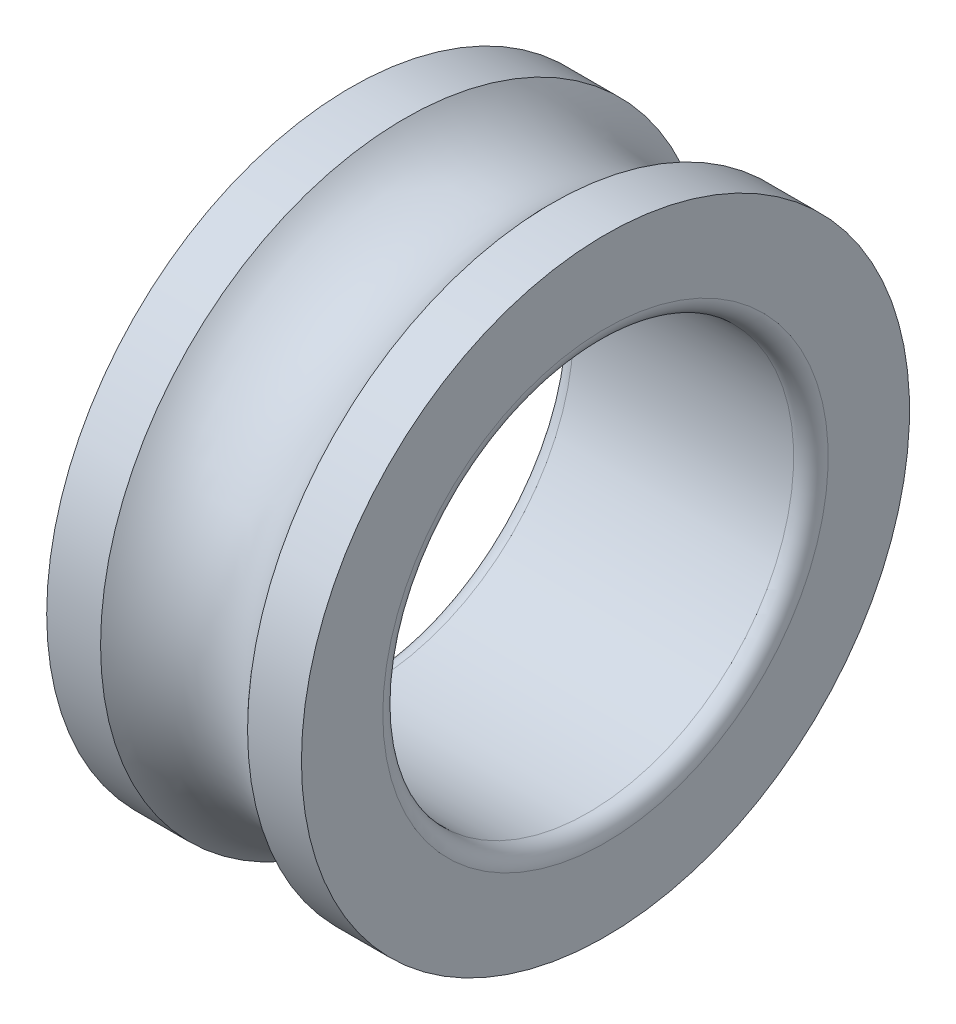
from build123d import *


with BuildPart() as part:
    # Sketch1 → Revolve1 (revolve)
    with BuildSketch(Plane.XY, mode=Mode.PRIVATE) as revolve1_sk:
        with BuildLine():
            Line((8.94427191, 37), (15.5, 37))
            Line((15.5, 37), (15.5, 27.1))
            ThreePointArc((15.5, 27.1), (14.88492424, 25.61507576), (13.4, 25))
            Line((13.4, 25), (-13.4, 25))
            ThreePointArc((-13.4, 25), (-14.88492424, 25.61507576), (-15.5, 27.1))
            Line((-15.5, 27.1), (-15.5, 37))
            Line((-15.5, 37), (-8.94427191, 37))
            ThreePointArc((-8.94427191, 37), (0, 33), (8.94427191, 37))
        make_face()
    revolve(revolve1_sk.sketch.rotate(Axis((-38.357904383, 0, 0), (1, 0, 0)), 90), axis=Axis((-38.357904383, 0, 0), (1, 0, 0)))


solid = part.part
